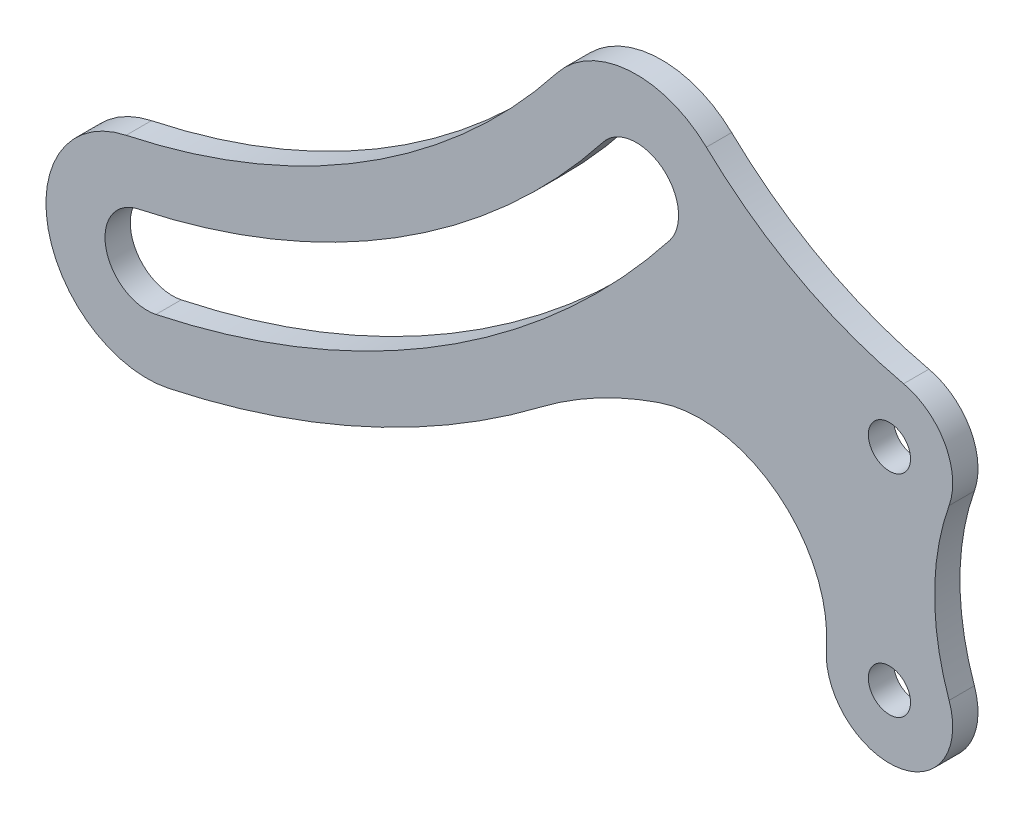
from build123d import *

# Parameters (mm, degrees)
EXTRUDE_1_DEPTH     = 3
EXTRUDE_2_DEPTH     = 3
SKETCH_3_R          = 2.5
CUT_EXTRUDE_1_DEPTH = 3
EXTRUDE_3_DEPTH     = 3
SKETCH_5_R          = 2.5
CUT_EXTRUDE_2_DEPTH = 108.032497136


with BuildPart() as part:
    # 草图1 → 凸台-拉伸1 (new body)
    with BuildSketch(Plane.XY):
        with BuildLine():
            ThreePointArc((-2.49494029, 11.737771209), (-11.737771209, -2.49494029), (2.49494029, -11.737771209))
            ThreePointArc((2.49494029, -11.737771209), (38.552147634, 2.82859918), (67.45494029, 28.846476198))
            ThreePointArc((67.45494029, 28.846476198), (65.389458987, 45.690875474), (48.54505971, 43.625394171))
            ThreePointArc((48.54505971, 43.625394171), (25.835722623, 23.182776515), (-2.49494029, 11.737771209))
        make_face()
        with BuildLine():
            ThreePointArc((61.939558454, 33.15699394), (34.843190339, 8.765234236), (1.039558454, -4.890738004))
            ThreePointArc((1.039558454, -4.890738004), (-4.890738004, -1.039558454), (-1.039558454, 4.890738004))
            ThreePointArc((-1.039558454, 4.890738004), (29.544679918, 17.246141459), (54.060441546, 39.314876429))
            ThreePointArc((54.060441546, 39.314876429), (61.078941244, 40.175493638), (61.939558454, 33.15699394))
        make_face(mode=Mode.SUBTRACT)
    extrude(amount=EXTRUDE_1_DEPTH)

    # 草图2 → 凸台-拉伸2 (add)
    with BuildSketch(Plane.XY):
        with BuildLine():
            ThreePointArc((89.676000633, 32.310336646), (77.132851548, 37.028551056), (66.293420251, 44.908834385))
            ThreePointArc((66.293420251, 44.908834385), (69.968747349, 37.101433246), (67.45494029, 28.846476198))
            ThreePointArc((67.45494029, 28.846476198), (57.764135997, 17.983287307), (46.746204448, 8.468785476))
            ThreePointArc((46.746204448, 8.468785476), (65.669563572, 17.30537468), (86.551758878, 17.641155141))
            ThreePointArc((86.551758878, 17.641155141), (95.33547477, 23.437690844), (89.676000633, 32.310336646))
        make_face()
    extrude(amount=EXTRUDE_2_DEPTH)

    # 草图3 → 切除-拉伸1 (cut)
    with BuildSketch(Plane.XY.offset(3)):
        with Locations((88, 25)):
            Circle(SKETCH_3_R)
    extrude(amount=-CUT_EXTRUDE_1_DEPTH, mode=Mode.SUBTRACT)

    # 草图4 → 凸台-拉伸3 (add)
    with BuildSketch(Plane.XY):
        with BuildLine():
            ThreePointArc((80.52135397, 0.56555597), (88.988457626, -7.4345781), (95.071067795, 2.500000049))
            ThreePointArc((95.071067795, 2.500000049), (93.355339059, 12.500000074), (95.071067844, 22.500000091))
            ThreePointArc((95.071067844, 22.500000091), (91.715661231, 18.485104635), (86.551758798, 17.641155157))
            ThreePointArc((86.551758798, 17.641155157), (73.513996149, 18.467623485), (60.707166945, 15.888586743))
            ThreePointArc((60.707166945, 15.888586743), (74.740298782, 13.562445033), (80.52135397, 0.56555597))
        make_face()
    extrude(amount=EXTRUDE_3_DEPTH)

    # 草图5 → 切除-拉伸2 (cut, through all)
    with BuildSketch(Plane.XY.offset(3)):
        with Locations((88, 0)):
            Circle(SKETCH_5_R)
    extrude(amount=-CUT_EXTRUDE_2_DEPTH, mode=Mode.SUBTRACT)


solid = part.part
